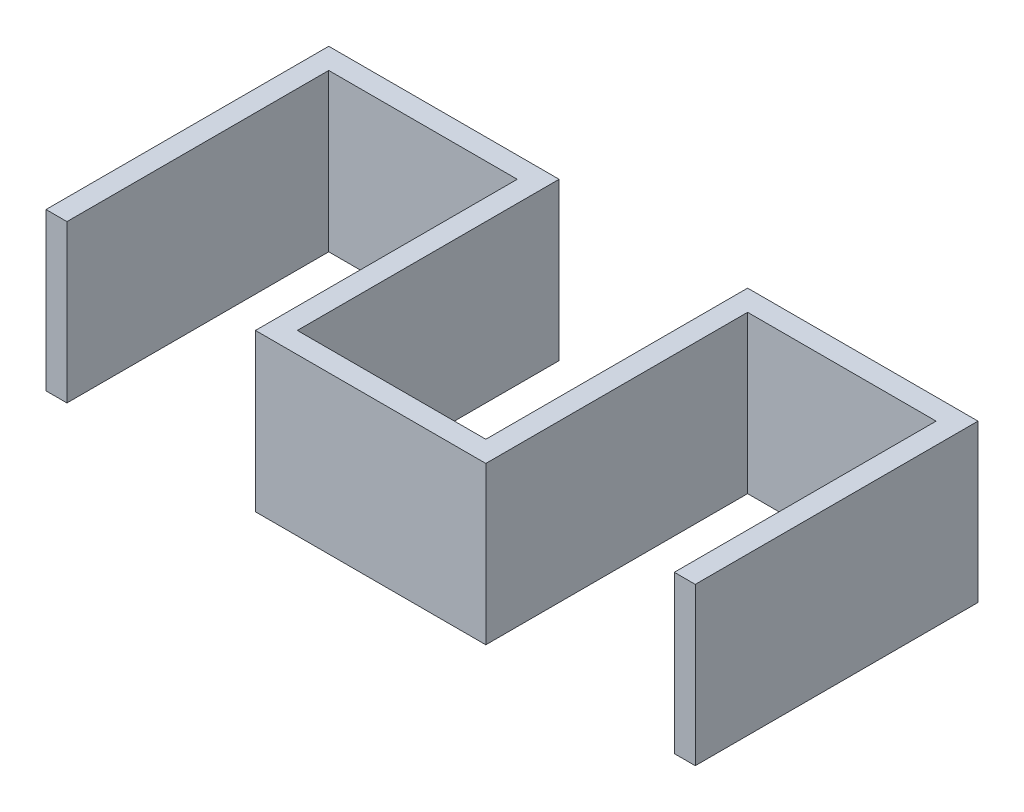
from build123d import *

# Parameters (mm, degrees)
EXTRUDE_THIN1_DEPTH = 15


with BuildPart() as part:
    # Sketch1 → Extrude-Thin1 (new body)
    with BuildSketch(Plane(origin=(0, 0, 0), x_dir=(1, 0, 0), z_dir=(0, 1, 0))):
        Polygon((0, 0), (0, 25), (18, 25), (18, 0), (40, 0), (40, 25), (58, 25), (58, 0), (60, 0), (60, 27), (38, 27), (38, 2), (20, 2), (20, 27), (-2, 27), (-2, 0), align=None)
    extrude(amount=EXTRUDE_THIN1_DEPTH)


solid = part.part
